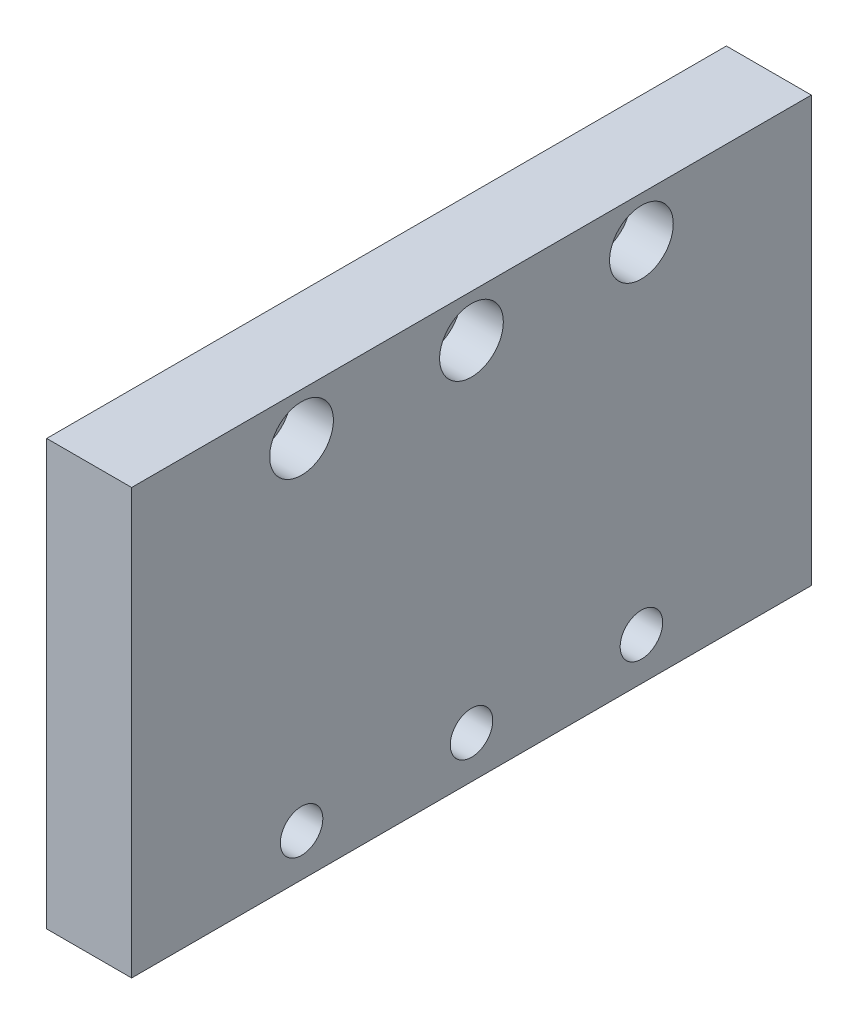
from build123d import *

# Parameters (mm, degrees)
BOSS_EXTRUDE1_DEPTH                           = 50.8
F_1_4_20_THREADED_C_BORE_D                    = 6.35
F_1_4_20_THREADED_C_BORE_CBORE_D              = 9.525
F_1_4_20_THREADED_C_BORE_CBORE_DEPTH          = 6.35
F_1_4_20_THREADED_C_BORE_OPPOSITE_D           = 6.35
F_1_4_20_THREADED_C_BORE_OPPOSITE_CBORE_D     = 9.525
F_1_4_20_THREADED_C_BORE_OPPOSITE_CBORE_DEPTH = 6.35


with BuildPart() as part:
    # Sketch2 → Boss-Extrude1 (new, symmetric)
    with BuildSketch(Plane.XY):
        Polygon((-6.35, 31.75), (6.35, 31.75), (6.35, -19.05), (6.35, -31.75), (-6.35, -31.75), (-6.35, 19.05), align=None)
    extrude(amount=BOSS_EXTRUDE1_DEPTH, both=True)

    # 1/4"-20 threaded c-bore (through all)
    with Locations(Plane.ZY.offset(6.35)):
        with Locations((-25.4, -25.4), (0, -25.4), (25.4, -25.4)):
            CounterBoreHole(F_1_4_20_THREADED_C_BORE_D / 2, F_1_4_20_THREADED_C_BORE_CBORE_D / 2, F_1_4_20_THREADED_C_BORE_CBORE_DEPTH)

    # 1/4"-20 threaded c-bore opposite (through all)
    with Locations(Plane(origin=(6.35, 0, 0), x_dir=(0, 0, -1), z_dir=(1, 0, 0))):
        with Locations((-25.4, 25.4), (0, 25.4), (25.4, 25.4)):
            CounterBoreHole(F_1_4_20_THREADED_C_BORE_OPPOSITE_D / 2, F_1_4_20_THREADED_C_BORE_OPPOSITE_CBORE_D / 2, F_1_4_20_THREADED_C_BORE_OPPOSITE_CBORE_DEPTH)


solid = part.part
